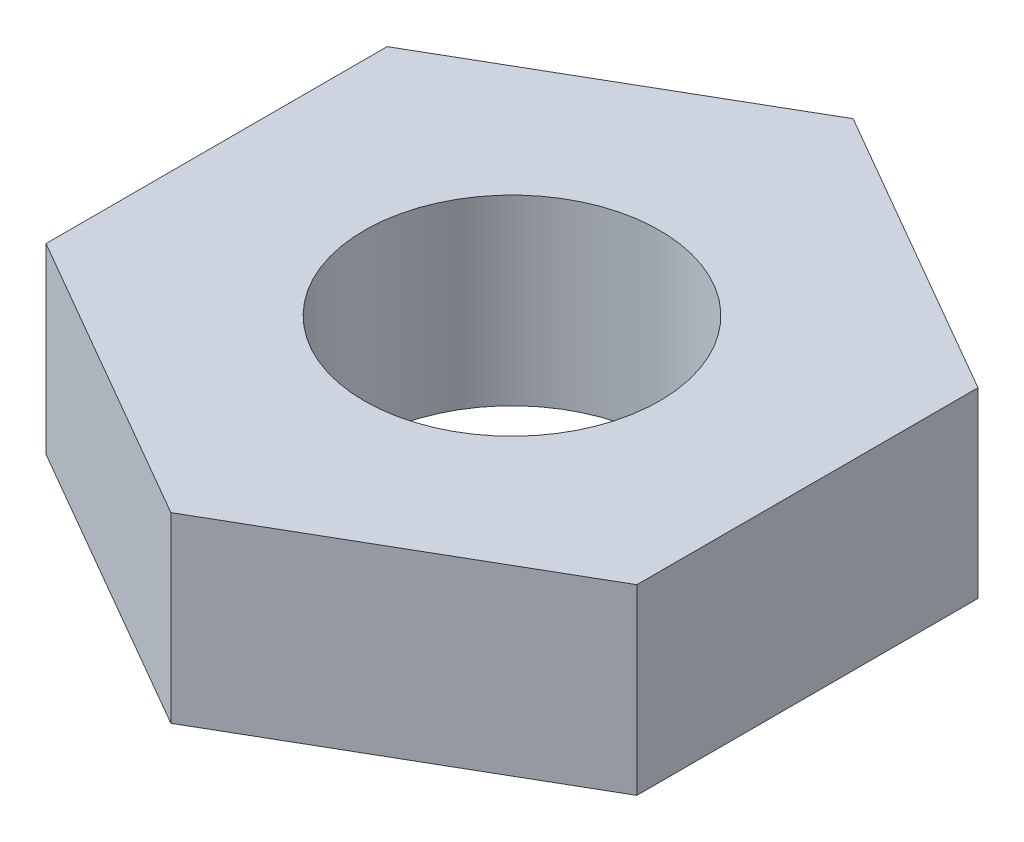
from build123d import *

# Parameters (mm, degrees)
SKETCH1_R           = 1.7272
BOSS_EXTRUDE1_DEPTH = 2.1336


with BuildPart() as part:
    # Sketch1 → Boss-Extrude1 (new body)
    with BuildSketch(Plane(origin=(0, 0, 0), x_dir=(1, 0, 0), z_dir=(0, 1, 0))):
        Polygon((3.4544, 1.99439877), (3.4544, -1.99439877), (0, -3.98879754), (-3.4544, -1.99439877), (-3.4544, 1.99439877), (0, 3.98879754), align=None)
        with Locations(Location((0, 0, 0), (0, 0, 270))):
            Circle(SKETCH1_R, mode=Mode.SUBTRACT)
    extrude(amount=BOSS_EXTRUDE1_DEPTH)


solid = part.part
